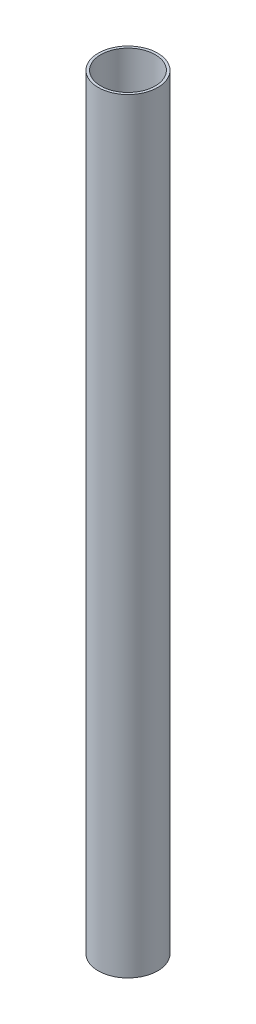
from build123d import *

# Parameters (mm, degrees)
CROQUIS1_R              = 17.5
CROQUIS1_R_2            = 16
SALIENTE_EXTRUIR1_DEPTH = 450


with BuildPart() as part:
    # Croquis1 → Saliente-Extruir1 (new body)
    with BuildSketch(Plane(origin=(0, 0, 0), x_dir=(1, 0, 0), z_dir=(0, 1, 0))):
        with Locations(Location((0, 0, 0), (0, 0, 270))):
            Circle(CROQUIS1_R)
        with Locations(Location((0, 0, 0), (0, 0, 270))):
            Circle(CROQUIS1_R_2, mode=Mode.SUBTRACT)
    extrude(amount=SALIENTE_EXTRUIR1_DEPTH)


solid = part.part
